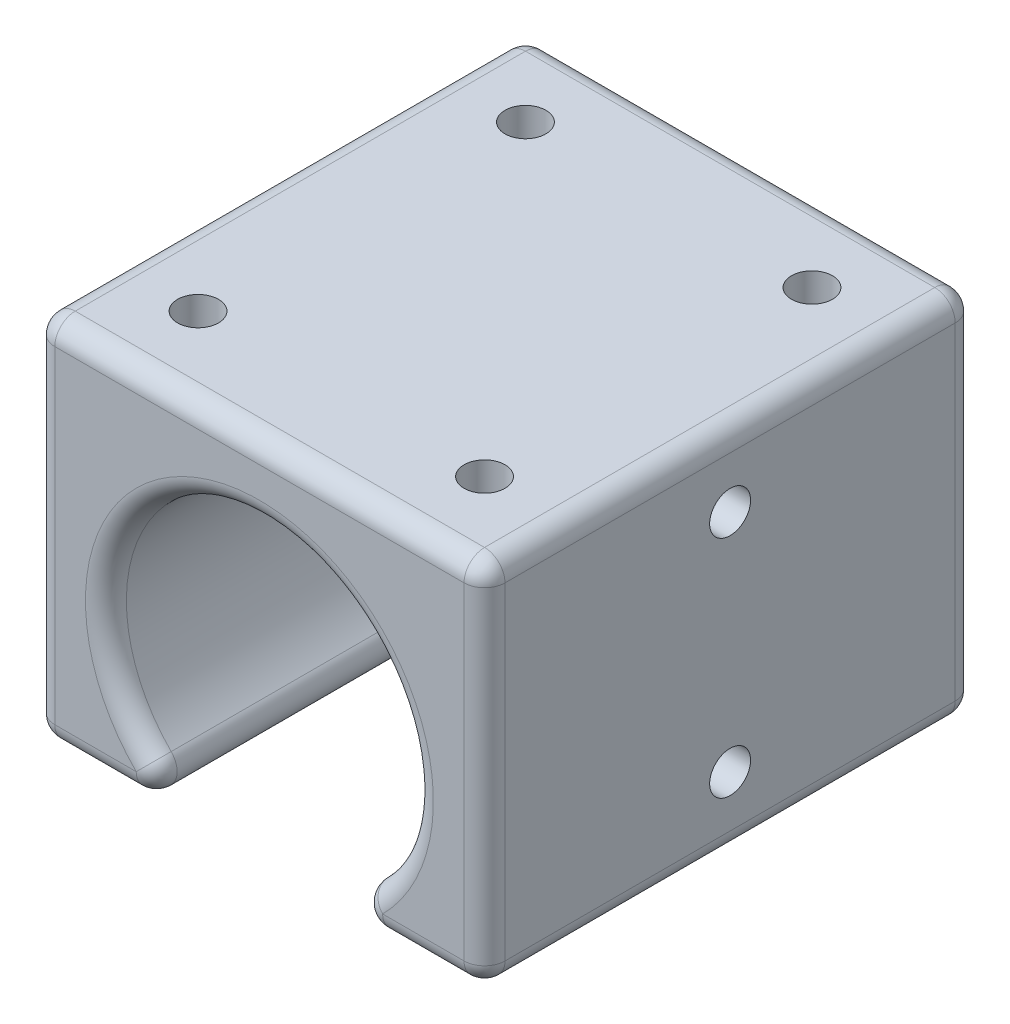
from build123d import *

# Parameters (mm, degrees)
BOSS_EXTRU_1_DEPTH      = 12
BOSS_EXTRU_1_DEPTH_BACK = 12
ENL_V_START             = 9
ESQUISSE2_R             = 1
ENL_V_MAT_EXTRU_1_DEPTH = 4
CONG_1_R                = 1
ESQUISSE3_R             = 1
ENL_V_MAT_EXTRU_2_DEPTH = 2.5
ENL_V_START_2           = -2.5
ESQUISSE6_R             = 1
ENL_V_MAT_EXTRU_4_DEPTH = 2.5


with BuildPart() as part:
    # Esquisse1 → Boss.-Extru.1 (new, two sides: drawn at the far end of the back side and taken through both)
    with BuildSketch(Plane.XY.offset(-BOSS_EXTRU_1_DEPTH_BACK)):
        with BuildLine():
            Line((11, -9), (2.692582404, -9))
            ThreePointArc((2.692582404, -9), (0, 5.5), (-2.692582404, -9))
            Line((-2.692582404, -9), (-11, -9))
            Line((-11, -9), (-11, 9))
            Line((-11, 9), (11, 9))
            Line((11, 9), (11, -9))
        make_face()
    extrude(amount=BOSS_EXTRU_1_DEPTH + BOSS_EXTRU_1_DEPTH_BACK)

    # Esquisse2 → Enlèv. mat.-Extru.1 (cut)
    with BuildSketch(Plane(origin=(0, 0, 0), x_dir=(1, 0, 0), z_dir=(0, 1, 0)).offset(ENL_V_START)):
        with Locations(Location((-7, 8, 0), (0, 0, 270))):
            Circle(ESQUISSE2_R)
        with Locations(Location((7, 8, 0), (0, 0, 270))):
            Circle(ESQUISSE2_R)
        with Locations(Location((7, -8, 0), (0, 0, 270))):
            Circle(ESQUISSE2_R)
        with Locations(Location((-7, -8, 0), (0, 0, 270))):
            Circle(ESQUISSE2_R)
    extrude(amount=-ENL_V_MAT_EXTRU_1_DEPTH, mode=Mode.SUBTRACT)

    # Congé1
    cong_1_edges = [part.edges().sort_by_distance(p)[0] for p in [
        (-11, 9, 0),
        (11, 9, 0),
        (11, -9, 0),
        (2.692582404, -9, 0),
        (-2.692582404, -9, 0),
        (-11, -9, 0),
        (0, 5.5, -12),
        (6.846291202, -9, -12),
        (-11, 0, 12),
        (-6.846291202, -9, 12),
        (0, 5.5, 12),
        (6.846291202, -9, 12),
        (11, 0, 12),
        (0, 9, 12),
        (11, 0, -12),
        (0, 9, -12),
        (-11, 0, -12),
        (-6.846291202, -9, -12),
    ]]
    fillet(cong_1_edges, radius=CONG_1_R)

    # Esquisse3 → Enlèv. mat.-Extru.2 (cut)
    with BuildSketch(Plane.ZY.offset(11)):
        with Locations((0, 5.5)):
            Circle(ESQUISSE3_R)
        with Locations((0, -5.5)):
            Circle(ESQUISSE3_R)
    extrude(amount=-ENL_V_MAT_EXTRU_2_DEPTH, mode=Mode.SUBTRACT)

    # Esquisse6 → Enlèv. mat.-Extru.4 (cut)
    with BuildSketch(Plane(origin=(11, 0, 0), x_dir=(0, 0, -1), z_dir=(1, 0, 0)).offset(ENL_V_START_2)):
        with Locations(Location((0, 5.5, 0), (0, 0, 180))):
            Circle(ESQUISSE6_R)
        with Locations(Location((0, -5.5, 0), (0, 0, 180))):
            Circle(ESQUISSE6_R)
    extrude(amount=ENL_V_MAT_EXTRU_4_DEPTH, mode=Mode.SUBTRACT)


solid = part.part
